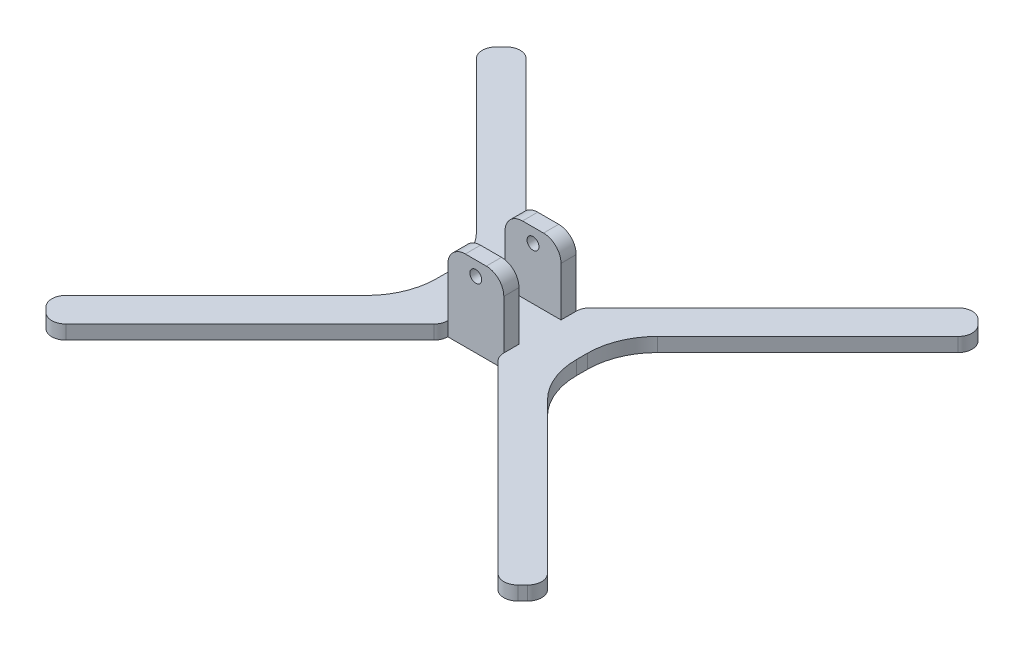
from build123d import *

# Parameters (mm, degrees)
BOSS_EXTRUDE2_DEPTH     = 2
FILLET1_R               = 2
FILLET2_R               = 10
ECHELLE1_SCALE          = 2
ESQUISSE1_W             = 16
ESQUISSE1_H             = 4.343145751
BOSS_EXTRU_1_DEPTH      = 23
ENL_V_MAT_EXTRU_1_REACH = 108.536
ESQUISSE2_R             = 1.7
CONG_1_R                = 5


with BuildPart() as part:
    # Sketch2 → Boss-Extrude2 (new body)
    with BuildSketch(Plane(origin=(0, 0, 0), x_dir=(1, 0, 0), z_dir=(0, 1, 0))):
        Polygon((4, 6), (32.284271247, 34.284271247), (35.819805153, 30.748737342), (10, 4.928932188), (10, -4.928932188), (35.819805153, -30.748737342), (32.284271247, -34.284271247), (4, -6), (4, -3), (-4, -3), (-4, -6), (-32.284271247, -34.284271247), (-35.819805153, -30.748737342), (-10, -4.928932188), (-10, 4.928932188), (-35.819805153, 30.748737342), (-32.284271247, 34.284271247), (-4, 6), (-4, 3), (4, 3), align=None)
    extrude(amount=BOSS_EXTRUDE2_DEPTH)

    # Fillet1
    fillet1_edges = [part.edges().sort_by_distance(p)[0] for p in [
        (4, 1, -6),
        (32.284271247, 1, -34.284271247),
        (35.819805153, 1, -30.748737342),
        (35.819805153, 1, 30.748737342),
        (32.284271247, 1, 34.284271247),
        (4, 1, 6),
        (-4, 1, 6),
        (-32.284271247, 1, 34.284271247),
        (-35.819805153, 1, 30.748737342),
        (-35.819805153, 1, -30.748737342),
        (-32.284271247, 1, -34.284271247),
        (-4, 1, -6),
    ]]
    fillet(fillet1_edges, radius=FILLET1_R)

    # Fillet2
    fillet2_edges = [part.edges().sort_by_distance(p)[0] for p in [
        (10, 1, -4.928932188),
        (10, 1, 4.928932188),
        (-10, 1, 4.928932188),
        (-10, 1, -4.928932188),
    ]]
    fillet(fillet2_edges, radius=FILLET2_R)


with BuildPart() as part_1:
    # Echelle1: scaled about (0, 1, 0)
    add(part.part.scale(ECHELLE1_SCALE).moved(Location((0, -1, 0))))

    # Esquisse1 → Boss.-Extru.1 (add)
    with BuildSketch(Plane.XZ.offset(1)):
        with Locations((0, -8.171572876)):
            Rectangle(ESQUISSE1_W, ESQUISSE1_H)
        with Locations((0, 8.171572876)):
            Rectangle(ESQUISSE1_W, ESQUISSE1_H)
    extrude(amount=-BOSS_EXTRU_1_DEPTH)

    # Enlèv. mat.-Extru.1: up to this face of the body (flat: up to its plane)
    enl_v_mat_extru_1_end = Plane(part_1.part.faces().sort_by_distance((0, 10.5, 10.343145751))[0])
    # Esquisse2 → Enlèv. mat.-Extru.1 (cut, up to the picked face)
    with BuildSketch(Plane(origin=(0, 0, -10.343145751), x_dir=(-1, 0, 0), z_dir=(0, 0, -1)), mode=Mode.PRIVATE) as enl_v_mat_extru_1_sk1:
        with Locations((0, 17.955923501)):
            Circle(ESQUISSE2_R)
    enl_v_mat_extru_1_tool1 = split(extrude(enl_v_mat_extru_1_sk1.sketch, amount=-ENL_V_MAT_EXTRU_1_REACH, mode=Mode.PRIVATE), bisect_by=enl_v_mat_extru_1_end, keep=Keep.BOTH, mode=Mode.PRIVATE)
    add(enl_v_mat_extru_1_tool1.solids().sort_by(Axis((0, 17.955924, -10.343146), (0, 0, 1)))[0], mode=Mode.SUBTRACT)

    # Congé1
    cong_1_edges = [part_1.edges().sort_by_distance(p)[0] for p in [
        (8, 22, -8.171572875),
        (-8, 22, -8.171572875),
        (8, 22, 8.171572875),
        (-8, 22, 8.171572875),
    ]]
    fillet(cong_1_edges, radius=CONG_1_R)


solid = part_1.part
